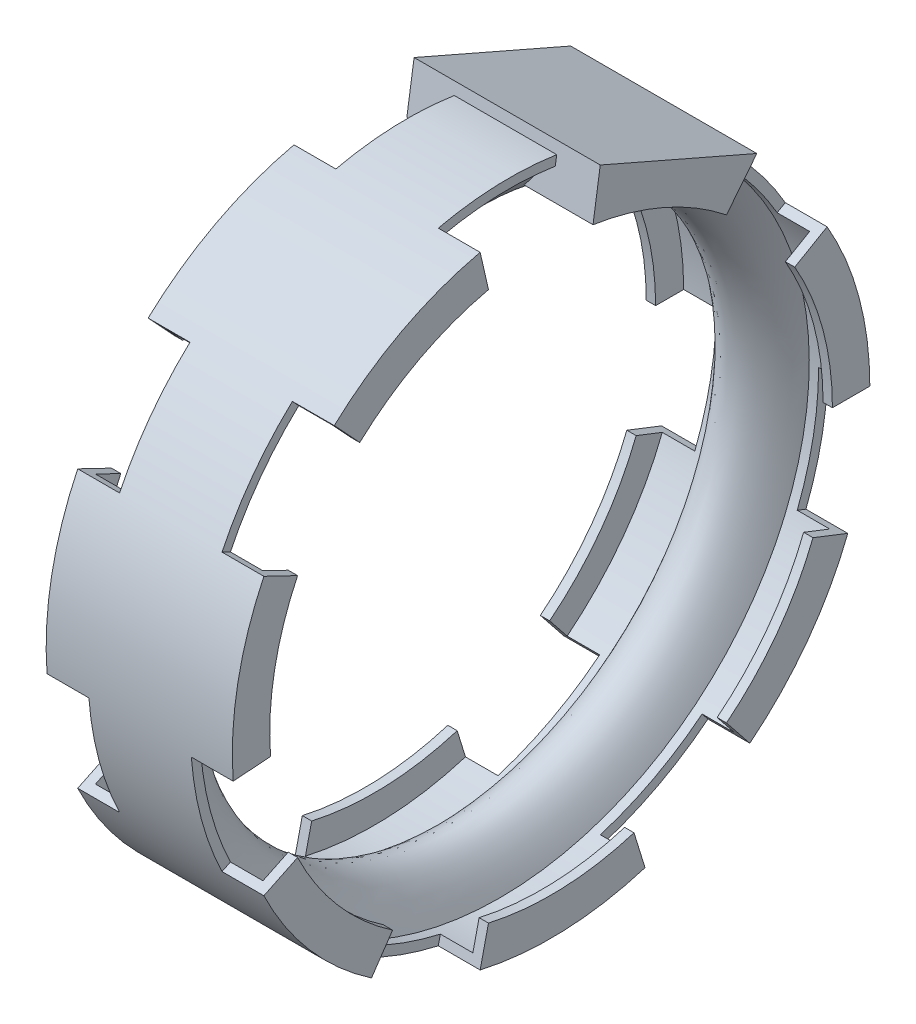
from build123d import *
from build123d.topology import SkipClean

# Parameters (mm, degrees)
REVOLVE2_ANGLE      = 30
CIRPATTERN1_COUNT   = 7
BOSS_EXTRUDE1_START = -198.999999613
BOSS_EXTRUDE1_DEPTH = 198.999999613


with BuildPart() as part:
    # Sketch3 → Revolve1 (revolve)
    with BuildSketch(Plane(origin=(0, 662.043515163, 0), x_dir=(1, 0, 0), z_dir=(0, 1, 0)), mode=Mode.PRIVATE) as revolve1_sk:
        with BuildLine():
            Line((-1082.838340054, 145.137569276), (-1082.838340054, 155.137569083))
            Line((-1082.838340054, 155.137569083), (-973.338340166, 155.137569083))
            Line((-973.338340166, 155.137569083), (-973.338340166, 145.137569276))
            Line((-973.338340166, 145.137569276), (-983.338339973, 145.137569083))
            add(Edge.make_bspline(
                [(-983.338339973, 145.137569083), (-1028.08834011, 55.637568906), (-1072.838340247, 145.137569827)],
                knots=[0, 0, 0, 1, 1, 1], degree=2))
            Line((-1072.838340247, 145.137569827), (-1082.838340054, 145.137569276))
        make_face()
    revolve(revolve1_sk.sketch.rotate(Axis((-1117.588339924, 662.043515163, 185.599272925), (1, 0, 0)), 180), axis=Axis((-1117.588339924, 662.043515163, 185.599272925), (1, 0, 0)))

    # Sketch4 → Revolve2 (revolve)
    with SkipClean():  # the faces are left unmerged after this step: merging them gives an invalid solid
        with BuildSketch(Plane(origin=(0, 662.043515163, 0), x_dir=(1, 0, 0), z_dir=(0, 1, 0))):
            with BuildLine():
                Line((-1072.838340247, 145.137569827), (-1117.588339924, 145.137569276))
                Line((-1117.588339924, 145.137569276), (-1117.588339924, 115.137569083))
                Line((-1117.588339924, 115.137569083), (-1127.588339731, 115.137569083))
                Line((-1127.588339731, 115.137569083), (-1127.588339731, 155.137569083))
                Line((-1127.588339731, 155.137569083), (-928.588340117, 155.137569083))
                Line((-928.588340117, 155.137569083), (-928.588340117, 115.137569083))
                Line((-928.588340117, 115.137569083), (-938.588339924, 115.137569083))
                Line((-938.588339924, 115.137569083), (-938.588339924, 145.137569185))
                Line((-938.588339924, 145.137569185), (-983.338339973, 145.137569083))
                add(Edge.make_bspline(
                    [(-983.338339973, 145.137569083), (-1028.08834011, 55.637568906), (-1072.838340247, 145.137569827)],
                    knots=[0, 0, 0, 1, 1, 1], degree=2))
            make_face()
        revolve2 = revolve(axis=Axis((-1117.588339924, 662.043515163, 185.599272925), (1, 0, 0)), revolution_arc=REVOLVE2_ANGLE)

    # CirPattern1: Revolve2 ×7 about axis
    with SkipClean():  # the faces are left unmerged after this step: merging them gives an invalid solid
        cirpattern1_axis = Axis((0, 662.043515163, 185.599272925), (1, 0, 0))
        for i in range(1, CIRPATTERN1_COUNT):
            add(revolve2.rotate(cirpattern1_axis, i * 360 / CIRPATTERN1_COUNT))

    # Sketch5 → Boss-Extrude1 (add)
    with SkipClean():  # the faces are left unmerged after this step: merging them gives an invalid solid
        with BuildSketch(Plane(origin=(-928.588340117, 0, 0), x_dir=(0, 0, -1), z_dir=(1, 0, 0)).offset(BOSS_EXTRUDE1_START)):
            with BuildLine():
                Line((-140.776772469, 959.421375123), (-134.815081822, 998.974608172))
                Line((-134.815081822, 998.974608172), (-133.023609535, 1010.860250194))
                Line((-133.023609535, 1010.860250194), (34.340954707, 937.83983727))
                Line((34.340954707, 937.83983727), (26.846673185, 928.442305482))
                Line((26.846673185, 928.442305482), (1.90708111, 897.169046183))
                ThreePointArc((1.90708111, 897.169046183), (-65.337008387, 937.687553498), (-140.776772469, 959.421375123))
            make_face()
        extrude(amount=BOSS_EXTRUDE1_DEPTH)


solid = part.part
